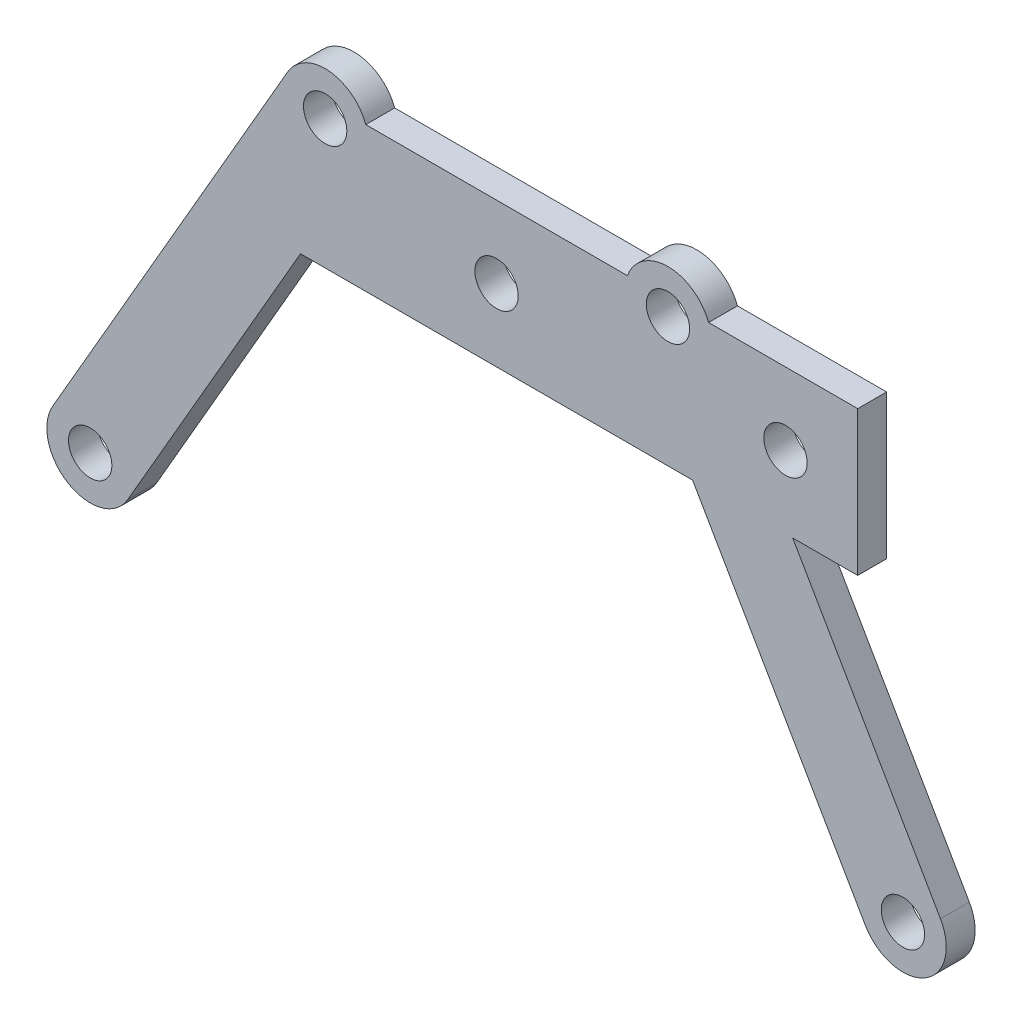
from build123d import *

# Parameters (mm, degrees)
SKETCH_1_W          = 30
SKETCH_1_H          = 10
SKETCH_1_R          = 1.5
EXTRUDE_1_DEPTH     = 2
SKETCH_4_R          = 1.5
EXTRUDE_3_DEPTH     = 2
SKETCH_5_R          = 1.5
CUT_EXTRUDE_2_DEPTH = 42.397139466


with BuildPart() as part:
    # 草图1 → 凸台-拉伸1 (new body)
    with BuildSketch(Plane.XY):
        with Locations((10, 0)):
            Rectangle(SKETCH_1_W, SKETCH_1_H)
        Circle(SKETCH_1_R, mode=Mode.SUBTRACT)
        with Locations((20, 0)):
            Circle(SKETCH_1_R, mode=Mode.SUBTRACT)
    extrude(amount=EXTRUDE_1_DEPTH)

    # 草图4 → 凸台-拉伸3 (add)
    # profile 1 of 3: a face of its own
    with BuildSketch(Plane(origin=(0, 0, 0), x_dir=(-1, 0, 0), z_dir=(0, 0, -1))):
        with BuildLine():
            Line((-30.725715478, -22.717516962), (-20.496502291, -5))
            Line((-20.496502291, -5), (-13.568299061, -5))
            Line((-13.568299061, -5), (-25.529563056, -25.717516962))
            ThreePointArc((-25.529563056, -25.717516962), (-29.627639267, -26.815593174), (-30.725715478, -22.717516962))
        make_face()
        with Locations((-28.127639267, -24.217516962)):
            Circle(SKETCH_4_R, mode=Mode.SUBTRACT)
    # profile 2 of 3: a face of its own
    with BuildSketch(Plane(origin=(0, 0, 0), x_dir=(-1, 0, 0), z_dir=(0, 0, -1))):
        with BuildLine():
            Line((-14.674826287, 5), (-12.937385919, 5))
            ThreePointArc((-12.937385919, 5), (-11.863593392, 5.452636831), (-10.789800864, 5))
            Line((-10.789800864, 5), (-9.052360496, 5))
            ThreePointArc((-9.052360496, 5), (-11.863593392, 6.952636831), (-14.674826287, 5))
        make_face()
    # profile 3 of 3: a face of its own
    with BuildSketch(Plane(origin=(0, 0, 0), x_dir=(-1, 0, 0), z_dir=(0, 0, -1))):
        with BuildLine():
            Line((5, 5), (9.052360496, 5))
            ThreePointArc((9.052360496, 5), (11.613435505, 6.942188809), (14.461669603, 5.452636831))
            Line((14.461669603, 5.452636831), (30.725715478, -22.717516962))
            ThreePointArc((30.725715478, -22.717516962), (29.627639267, -26.815593174), (25.529563056, -25.717516962))
            Line((25.529563056, -25.717516962), (13.568299061, -5))
            Line((13.568299061, -5), (5, -5))
            Line((5, -5), (5, 5))
        make_face()
        with Locations((11.863593392, 3.952636831)):
            Circle(SKETCH_4_R, mode=Mode.SUBTRACT)
        with Locations((28.127639267, -24.217516962)):
            Circle(SKETCH_4_R, mode=Mode.SUBTRACT)
    extrude(amount=-EXTRUDE_3_DEPTH)

    # 草图5 → 切除-拉伸2 (cut, through all)
    with BuildSketch(Plane(origin=(0, 0, 0), x_dir=(-1, 0, 0), z_dir=(0, 0, -1))):
        with Locations((-11.863593392, 3.952636831)):
            Circle(SKETCH_5_R)
    extrude(amount=-CUT_EXTRUDE_2_DEPTH, mode=Mode.SUBTRACT)


solid = part.part
